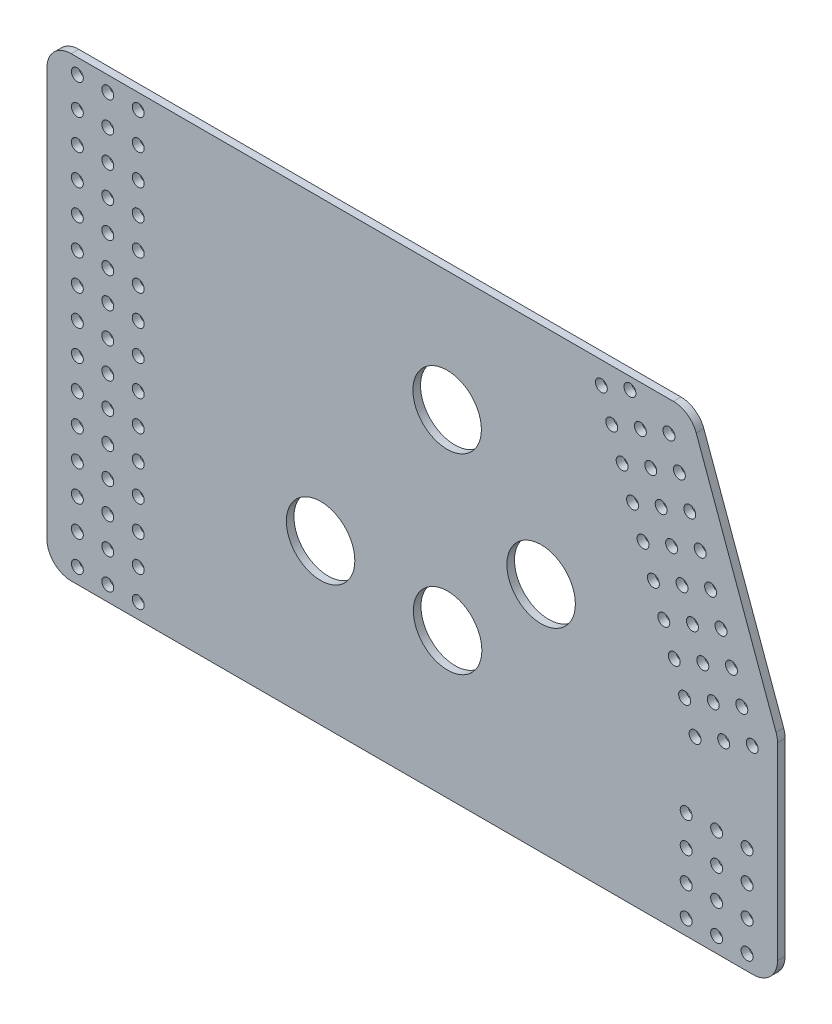
from build123d import *

# Parameters (mm, degrees)
SKETCH2_R           = 2.4892
SKETCH2_R_2         = 14.2875
BOSS_EXTRUDE1_DEPTH = 3.175
FILLET1_R           = 10.16


with BuildPart() as part:
    # Sketch2 → Boss-Extrude1 (new body)
    with BuildSketch(Plane.XY):
        Polygon((-62.034734806, 275.060295422), (206.435304788, 275.060295422), (242.765265194, 175.244549557), (242.765265194, 84.560295422), (-62.034734806, 84.560295422), align=None)
        with Locations((-49.334734806, 268.710295422)):
            Circle(SKETCH2_R, mode=Mode.SUBTRACT)
        with Locations((-49.334734806, 90.910295422)):
            Circle(SKETCH2_R, mode=Mode.SUBTRACT)
        with Locations((-36.634734806, 268.710295422)):
            Circle(SKETCH2_R, mode=Mode.SUBTRACT)
        with Locations((-23.934734806, 268.710295422)):
            Circle(SKETCH2_R, mode=Mode.SUBTRACT)
        with Locations((-36.634734806, 256.010295422)):
            Circle(SKETCH2_R, mode=Mode.SUBTRACT)
        with Locations((-23.934734806, 256.010295422)):
            Circle(SKETCH2_R, mode=Mode.SUBTRACT)
        with Locations((-36.634734806, 243.310295422)):
            Circle(SKETCH2_R, mode=Mode.SUBTRACT)
        with Locations((-23.934734806, 243.310295422)):
            Circle(SKETCH2_R, mode=Mode.SUBTRACT)
        with Locations((-36.634734806, 230.610295422)):
            Circle(SKETCH2_R, mode=Mode.SUBTRACT)
        with Locations((-23.934734806, 230.610295422)):
            Circle(SKETCH2_R, mode=Mode.SUBTRACT)
        with Locations((-36.634734806, 217.910295422)):
            Circle(SKETCH2_R, mode=Mode.SUBTRACT)
        with Locations((-23.934734806, 217.910295422)):
            Circle(SKETCH2_R, mode=Mode.SUBTRACT)
        with Locations((-36.634734806, 205.210295422)):
            Circle(SKETCH2_R, mode=Mode.SUBTRACT)
        with Locations((-23.934734806, 205.210295422)):
            Circle(SKETCH2_R, mode=Mode.SUBTRACT)
        with Locations((-36.634734806, 192.510295422)):
            Circle(SKETCH2_R, mode=Mode.SUBTRACT)
        with Locations((-23.934734806, 192.510295422)):
            Circle(SKETCH2_R, mode=Mode.SUBTRACT)
        with Locations((-36.634734806, 179.810295422)):
            Circle(SKETCH2_R, mode=Mode.SUBTRACT)
        with Locations((-23.934734806, 179.810295422)):
            Circle(SKETCH2_R, mode=Mode.SUBTRACT)
        with Locations((-36.634734806, 167.110295422)):
            Circle(SKETCH2_R, mode=Mode.SUBTRACT)
        with Locations((-23.934734806, 167.110295422)):
            Circle(SKETCH2_R, mode=Mode.SUBTRACT)
        with Locations((-36.634734806, 154.410295422)):
            Circle(SKETCH2_R, mode=Mode.SUBTRACT)
        with Locations((-23.934734806, 154.410295422)):
            Circle(SKETCH2_R, mode=Mode.SUBTRACT)
        with Locations((-36.634734806, 141.710295422)):
            Circle(SKETCH2_R, mode=Mode.SUBTRACT)
        with Locations((-23.934734806, 141.710295422)):
            Circle(SKETCH2_R, mode=Mode.SUBTRACT)
        with Locations((-36.634734806, 129.010295422)):
            Circle(SKETCH2_R, mode=Mode.SUBTRACT)
        with Locations((-23.934734806, 129.010295422)):
            Circle(SKETCH2_R, mode=Mode.SUBTRACT)
        with Locations((-36.634734806, 116.310295422)):
            Circle(SKETCH2_R, mode=Mode.SUBTRACT)
        with Locations((-23.934734806, 116.310295422)):
            Circle(SKETCH2_R, mode=Mode.SUBTRACT)
        with Locations((-36.634734806, 103.610295422)):
            Circle(SKETCH2_R, mode=Mode.SUBTRACT)
        with Locations((-23.934734806, 103.610295422)):
            Circle(SKETCH2_R, mode=Mode.SUBTRACT)
        with Locations((-36.634734806, 90.910295422)):
            Circle(SKETCH2_R, mode=Mode.SUBTRACT)
        with Locations((-23.934734806, 90.910295422)):
            Circle(SKETCH2_R, mode=Mode.SUBTRACT)
        with Locations((-49.334734806, 256.010295422)):
            Circle(SKETCH2_R, mode=Mode.SUBTRACT)
        with Locations((-49.334734806, 243.310295422)):
            Circle(SKETCH2_R, mode=Mode.SUBTRACT)
        with Locations((-49.334734806, 230.610295422)):
            Circle(SKETCH2_R, mode=Mode.SUBTRACT)
        with Locations((-49.334734806, 217.910295422)):
            Circle(SKETCH2_R, mode=Mode.SUBTRACT)
        with Locations((-49.334734806, 205.210295422)):
            Circle(SKETCH2_R, mode=Mode.SUBTRACT)
        with Locations((-49.334734806, 192.510295422)):
            Circle(SKETCH2_R, mode=Mode.SUBTRACT)
        with Locations((-49.334734806, 179.810295422)):
            Circle(SKETCH2_R, mode=Mode.SUBTRACT)
        with Locations((-49.334734806, 167.110295422)):
            Circle(SKETCH2_R, mode=Mode.SUBTRACT)
        with Locations((-49.334734806, 154.410295422)):
            Circle(SKETCH2_R, mode=Mode.SUBTRACT)
        with Locations((-49.334734806, 141.710295422)):
            Circle(SKETCH2_R, mode=Mode.SUBTRACT)
        with Locations((-49.334734806, 129.010295422)):
            Circle(SKETCH2_R, mode=Mode.SUBTRACT)
        with Locations((-49.334734806, 116.310295422)):
            Circle(SKETCH2_R, mode=Mode.SUBTRACT)
        with Locations((-49.334734806, 103.610295422)):
            Circle(SKETCH2_R, mode=Mode.SUBTRACT)
        with Locations((169.26865969, 265.77786594)):
            Circle(SKETCH2_R, mode=Mode.SUBTRACT)
        with Locations((181.202755974, 270.121521761)):
            Circle(SKETCH2_R, mode=Mode.SUBTRACT)
        with Locations((197.480508078, 262.531081297)):
            Circle(SKETCH2_R, mode=Mode.SUBTRACT)
        with Locations((173.61231551, 253.843769656)):
            Circle(SKETCH2_R, mode=Mode.SUBTRACT)
        with Locations((185.546411794, 258.187425477)):
            Circle(SKETCH2_R, mode=Mode.SUBTRACT)
        with Locations((201.824163899, 250.596985013)):
            Circle(SKETCH2_R, mode=Mode.SUBTRACT)
        with Locations((177.955971331, 241.909673372)):
            Circle(SKETCH2_R, mode=Mode.SUBTRACT)
        with Locations((189.890067615, 246.253329193)):
            Circle(SKETCH2_R, mode=Mode.SUBTRACT)
        with Locations((206.167819719, 238.662888729)):
            Circle(SKETCH2_R, mode=Mode.SUBTRACT)
        with Locations((182.299627151, 229.975577088)):
            Circle(SKETCH2_R, mode=Mode.SUBTRACT)
        with Locations((194.233723435, 234.319232909)):
            Circle(SKETCH2_R, mode=Mode.SUBTRACT)
        with Locations((210.511475539, 226.728792445)):
            Circle(SKETCH2_R, mode=Mode.SUBTRACT)
        with Locations((186.643282971, 218.041480804)):
            Circle(SKETCH2_R, mode=Mode.SUBTRACT)
        with Locations((198.577379255, 222.385136625)):
            Circle(SKETCH2_R, mode=Mode.SUBTRACT)
        with Locations((214.855131359, 214.794696161)):
            Circle(SKETCH2_R, mode=Mode.SUBTRACT)
        with Locations((190.986938791, 206.10738452)):
            Circle(SKETCH2_R, mode=Mode.SUBTRACT)
        with Locations((202.921035075, 210.451040341)):
            Circle(SKETCH2_R, mode=Mode.SUBTRACT)
        with Locations((219.19878718, 202.860599877)):
            Circle(SKETCH2_R, mode=Mode.SUBTRACT)
        with Locations((195.330594612, 194.173288236)):
            Circle(SKETCH2_R, mode=Mode.SUBTRACT)
        with Locations((207.264690896, 198.516944057)):
            Circle(SKETCH2_R, mode=Mode.SUBTRACT)
        with Locations((223.542443, 190.926503593)):
            Circle(SKETCH2_R, mode=Mode.SUBTRACT)
        with Locations((199.674250432, 182.239191952)):
            Circle(SKETCH2_R, mode=Mode.SUBTRACT)
        with Locations((211.608346716, 186.582847773)):
            Circle(SKETCH2_R, mode=Mode.SUBTRACT)
        with Locations((227.88609882, 178.992407309)):
            Circle(SKETCH2_R, mode=Mode.SUBTRACT)
        with Locations((204.017906252, 170.305095668)):
            Circle(SKETCH2_R, mode=Mode.SUBTRACT)
        with Locations((215.952002536, 174.648751489)):
            Circle(SKETCH2_R, mode=Mode.SUBTRACT)
        with Locations((232.22975464, 167.058311025)):
            Circle(SKETCH2_R, mode=Mode.SUBTRACT)
        with Locations((208.361562072, 158.370999384)):
            Circle(SKETCH2_R, mode=Mode.SUBTRACT)
        with Locations((220.295658356, 162.714655205)):
            Circle(SKETCH2_R, mode=Mode.SUBTRACT)
        with Locations((204.665265194, 129.010295422)):
            Circle(SKETCH2_R, mode=Mode.SUBTRACT)
        with Locations((217.365265194, 129.010295422)):
            Circle(SKETCH2_R, mode=Mode.SUBTRACT)
        with Locations((230.065265194, 129.010295422)):
            Circle(SKETCH2_R, mode=Mode.SUBTRACT)
        with Locations((204.665265194, 116.310295422)):
            Circle(SKETCH2_R, mode=Mode.SUBTRACT)
        with Locations((217.365265194, 116.310295422)):
            Circle(SKETCH2_R, mode=Mode.SUBTRACT)
        with Locations((230.065265194, 116.310295422)):
            Circle(SKETCH2_R, mode=Mode.SUBTRACT)
        with Locations((204.665265194, 103.610295422)):
            Circle(SKETCH2_R, mode=Mode.SUBTRACT)
        with Locations((217.365265194, 103.610295422)):
            Circle(SKETCH2_R, mode=Mode.SUBTRACT)
        with Locations((230.065265194, 103.610295422)):
            Circle(SKETCH2_R, mode=Mode.SUBTRACT)
        with Locations((204.665265194, 90.910295422)):
            Circle(SKETCH2_R, mode=Mode.SUBTRACT)
        with Locations((217.365265194, 90.910295422)):
            Circle(SKETCH2_R, mode=Mode.SUBTRACT)
        with Locations((230.065265194, 90.910295422)):
            Circle(SKETCH2_R, mode=Mode.SUBTRACT)
        with Locations((52.142163008, 151.05639055)):
            Circle(SKETCH2_R_2, mode=Mode.SUBTRACT)
        with Locations((105.13926409, 145.139641068)):
            Circle(SKETCH2_R_2, mode=Mode.SUBTRACT)
        with Locations((104.944740556, 224.82726801)):
            Circle(SKETCH2_R_2, mode=Mode.SUBTRACT)
        with Locations((144.142354475, 181.392565924)):
            Circle(SKETCH2_R_2, mode=Mode.SUBTRACT)
    extrude(amount=BOSS_EXTRUDE1_DEPTH)

    # Fillet1
    fillet1_edges = [part.edges().sort_by_distance(p)[0] for p in [
        (-62.034734806, 275.060295422, 1.5875),
        (206.435304788, 275.060295422, 1.5875),
        (242.765265194, 175.244549557, 1.5875),
        (242.765265194, 84.560295422, 1.5875),
        (-62.034734806, 84.560295422, 1.5875),
    ]]
    fillet(fillet1_edges, radius=FILLET1_R)


solid = part.part
